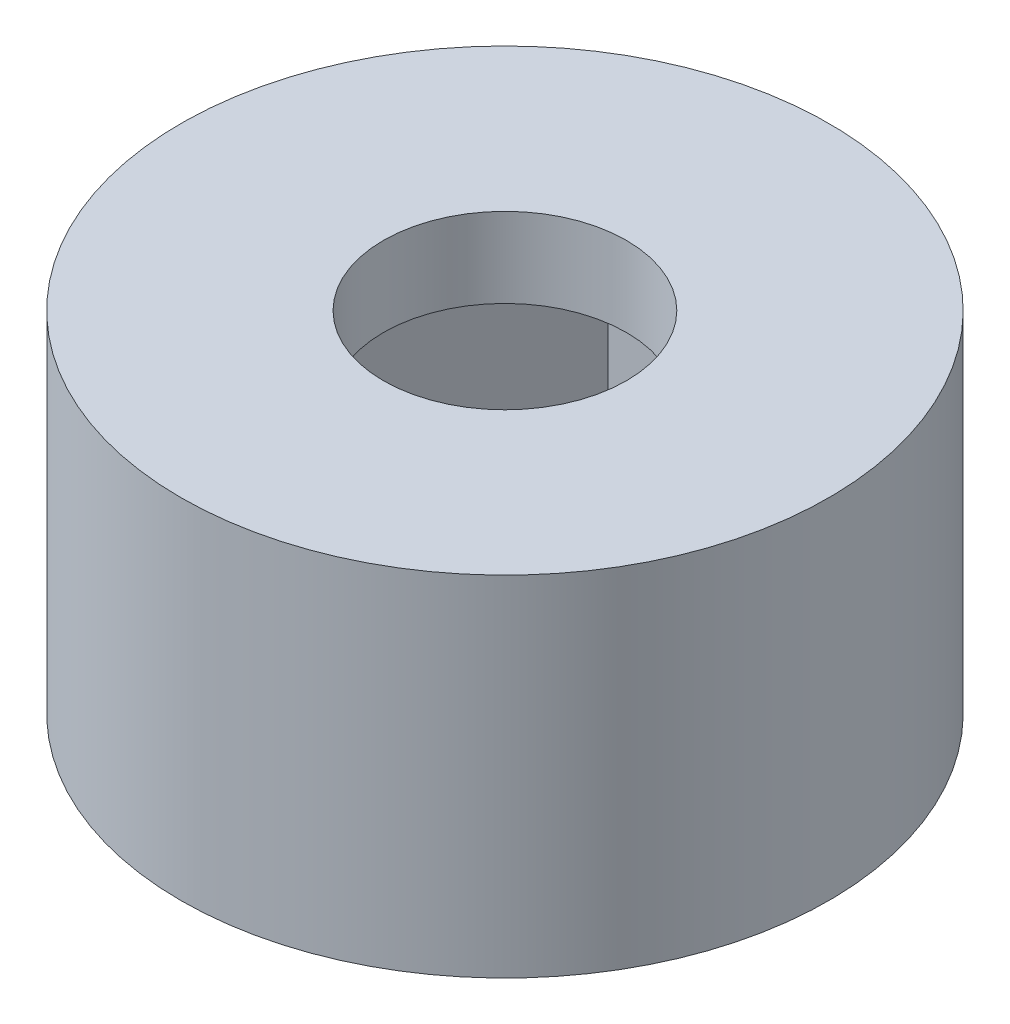
from build123d import *

# Parameters (mm, degrees)
SKETCH1_R             = 3.25
BOSS_EXTRUDE1_DEPTH   = 1.75
CUT_EXTRUDE1_DEPTH    = 0.95
F_2_CLEARANCE_HOLE1_D = 2.4384


with BuildPart() as part:
    # Sketch1 → Boss-Extrude1 (new, symmetric)
    with BuildSketch(Plane(origin=(0, 0, 0), x_dir=(1, 0, 0), z_dir=(0, 1, 0))):
        with Locations(Location((0, 0, 0), (0, 0, 270))):
            Circle(SKETCH1_R)
    extrude(amount=BOSS_EXTRUDE1_DEPTH, both=True)

    # Sketch2 → Cut-Extrude1 (cut, symmetric)
    with BuildSketch(Plane(origin=(0, 0, 0), x_dir=(1, 0, 0), z_dir=(0, 1, 0))):
        Polygon((2.829016319, 0), (1.41450816, 2.45), (-1.41450816, 2.45), (-2.829016319, 0), (-1.41450816, -2.45), (1.41450816, -2.45), align=None)
    extrude(amount=CUT_EXTRUDE1_DEPTH, both=True, mode=Mode.SUBTRACT)

    # #2 Clearance Hole1 (through all)
    with Locations(Plane(origin=(0, 1.75, 0), x_dir=(1, 0, 0), z_dir=(0, 1, 0))):
        with Locations((0, 0)):
            Hole(F_2_CLEARANCE_HOLE1_D / 2)


solid = part.part
